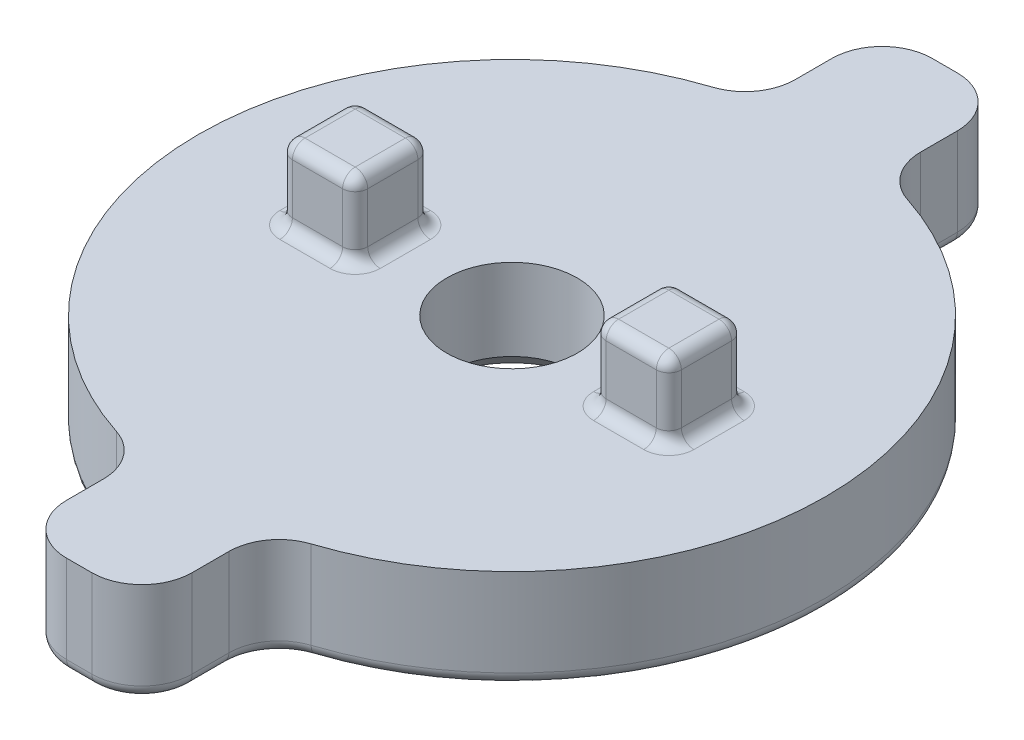
from build123d import *

# Parameters (mm, degrees)
SKETCH1_R           = 1.85
BOSS_EXTRUDE1_DEPTH = 4
SKETCH1_3_W         = 3
SKETCH1_3_H         = 3
BOSS_EXTRUDE2_DEPTH = 3
CHAMFER1_SIZE       = 1.5
SKETCH2_R           = 2.6
CUT_EXTRUDE1_DEPTH  = 4
FILLET1_R           = 0.5


with BuildPart() as part:
    # Sketch1 → Boss-Extrude1 (new body)
    with BuildSketch(Plane(origin=(0, 0, 0), x_dir=(1, 0, 0), z_dir=(0, 1, 0))):
        with BuildLine():
            Line((-2.5, 13.784048752), (-2.5, 15.247448714))
            ThreePointArc((-2.5, 15.247448714), (-1.914213562, 16.661662276), (-0.5, 17.247448714))
            Line((-0.5, 17.247448714), (0.5, 17.247448714))
            ThreePointArc((0.5, 17.247448714), (1.914213562, 16.661662276), (2.5, 15.247448714))
            Line((2.5, 15.247448714), (2.5, 13.784048752))
            ThreePointArc((2.5, 13.784048752), (2.881145573, 12.609608313), (3.879310345, 11.882800648))
            ThreePointArc((3.879310345, 11.882800648), (12.5, 0), (3.879310345, -11.882800648))
            ThreePointArc((3.879310345, -11.882800648), (2.881145573, -12.609608313), (2.5, -13.784048752))
            Line((2.5, -13.784048752), (2.5, -15.247448714))
            ThreePointArc((2.5, -15.247448714), (1.914213562, -16.661662276), (0.5, -17.247448714))
            Line((0.5, -17.247448714), (-0.5, -17.247448714))
            ThreePointArc((-0.5, -17.247448714), (-1.914213562, -16.661662276), (-2.5, -15.247448714))
            Line((-2.5, -15.247448714), (-2.5, -13.784048752))
            ThreePointArc((-2.5, -13.784048752), (-2.881145573, -12.609608313), (-3.879310345, -11.882800648))
            ThreePointArc((-3.879310345, -11.882800648), (-12.5, 0), (-3.879310345, 11.882800648))
            ThreePointArc((-3.879310345, 11.882800648), (-2.881145573, 12.609608313), (-2.5, 13.784048752))
        make_face()
        with Locations(Location((0, 0, 0), (0, 0, 270))):
            Circle(SKETCH1_R, mode=Mode.SUBTRACT)
    extrude(amount=-BOSS_EXTRUDE1_DEPTH)

    # Sketch1<3> → Boss-Extrude2 (add)
    with BuildSketch(Plane(origin=(0, 0, 0), x_dir=(1, 0, 0), z_dir=(0, 1, 0))):
        with Locations((-6.25, 0)):
            Rectangle(SKETCH1_3_W, SKETCH1_3_H)
        with Locations((6.25, 0)):
            Rectangle(SKETCH1_3_W, SKETCH1_3_H)
    extrude(amount=BOSS_EXTRUDE2_DEPTH)

    # Chamfer1
    chamfer1_edges = [part.edges().sort_by_distance(p)[0] for p in [
        (0, -4, -1.85),
    ]]
    chamfer(chamfer1_edges, length=CHAMFER1_SIZE)

    # Sketch2 → Cut-Extrude1 (cut)
    with BuildSketch(Plane.XZ.offset(4)):
        with Locations(Location((0, 0, 0), (0, 0, 270))):
            Circle(SKETCH2_R)
    extrude(amount=-CUT_EXTRUDE1_DEPTH, mode=Mode.SUBTRACT)

    # Fillet1
    fillet1_edges = [part.edges().sort_by_distance(p)[0] for p in [
        (-2.5, -4, -14.515748733),
        (-2.881145573, -4, -12.609608313),
        (-12.5, -4, 0),
        (-2.881145573, -4, 12.609608313),
        (-2.5, -4, 14.515748733),
        (-1.914213562, -4, 16.661662276),
        (0, -4, 17.247448714),
        (1.914213562, -4, 16.661662276),
        (2.5, -4, 14.515748733),
        (-4.75, 3, 0),
        (-4.75, 1.5, 1.5),
        (-6.25, 0, -1.5),
        (-4.75, 1.5, -1.5),
        (-7.75, 0, 0),
        (2.881145573, -4, 12.609608313),
        (-7.75, 1.5, -1.5),
        (-6.25, 3, 1.5),
        (-7.75, 1.5, 1.5),
        (-6.25, 3, -1.5),
        (-7.75, 3, 0),
        (-4.75, 0, 0),
        (-6.25, 0, 1.5),
        (-1.914213562, -4, -16.661662276),
        (12.5, -4, 0),
        (2.881145573, -4, -12.609608313),
        (7.75, 3, 0),
        (7.75, 1.5, 1.5),
        (6.25, 3, -1.5),
        (7.75, 1.5, -1.5),
        (4.75, 0, 0),
        (4.75, 1.5, -1.5),
        (6.25, 0, 1.5),
        (4.75, 1.5, 1.5),
        (4.75, 3, 0),
        (6.25, 3, 1.5),
        (7.75, 0, 0),
        (6.25, 0, -1.5),
        (2.5, -4, -14.515748733),
        (1.914213562, -4, -16.661662276),
        (0, -4, -17.247448714),
    ]]
    fillet(fillet1_edges, radius=FILLET1_R)


solid = part.part
